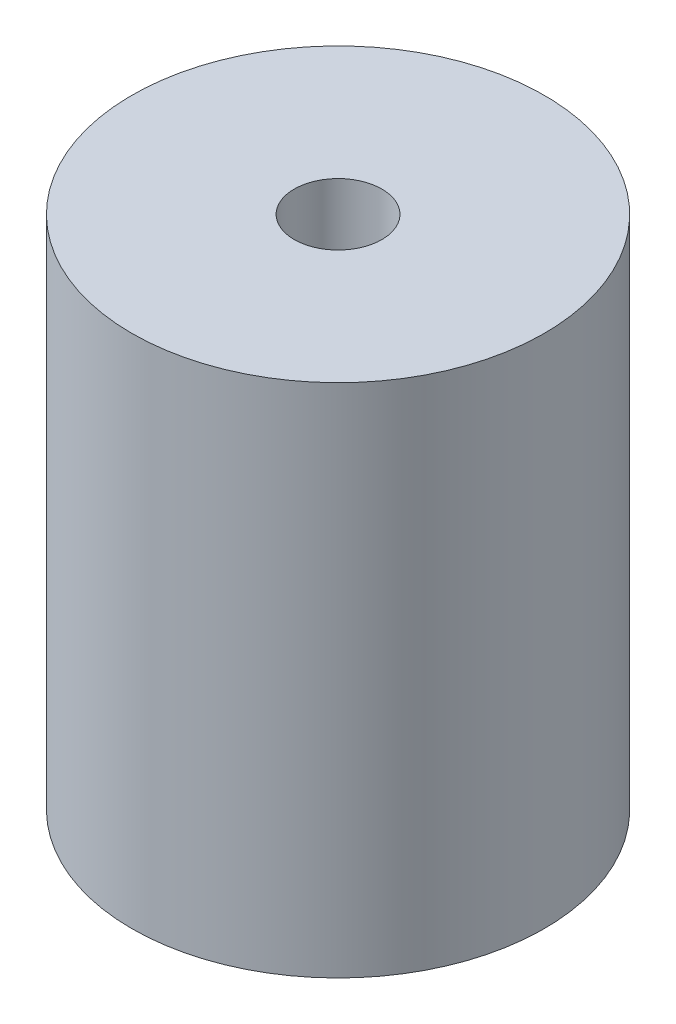
from build123d import *

# Parameters (mm, degrees)
SKETCH_1_R      = 8
SKETCH_1_R_2    = 1.7
EXTRUDE_1_DEPTH = 20


with BuildPart() as part:
    # 草图1 → 凸台-拉伸1 (new body)
    with BuildSketch(Plane(origin=(0, 0, 0), x_dir=(1, 0, 0), z_dir=(0, 1, 0))):
        with Locations(Location((0, 0, 0), (0, 0, 270))):
            Circle(SKETCH_1_R)
        with Locations(Location((0, 0, 0), (0, 0, 270))):
            Circle(SKETCH_1_R_2, mode=Mode.SUBTRACT)
    extrude(amount=EXTRUDE_1_DEPTH)


solid = part.part
